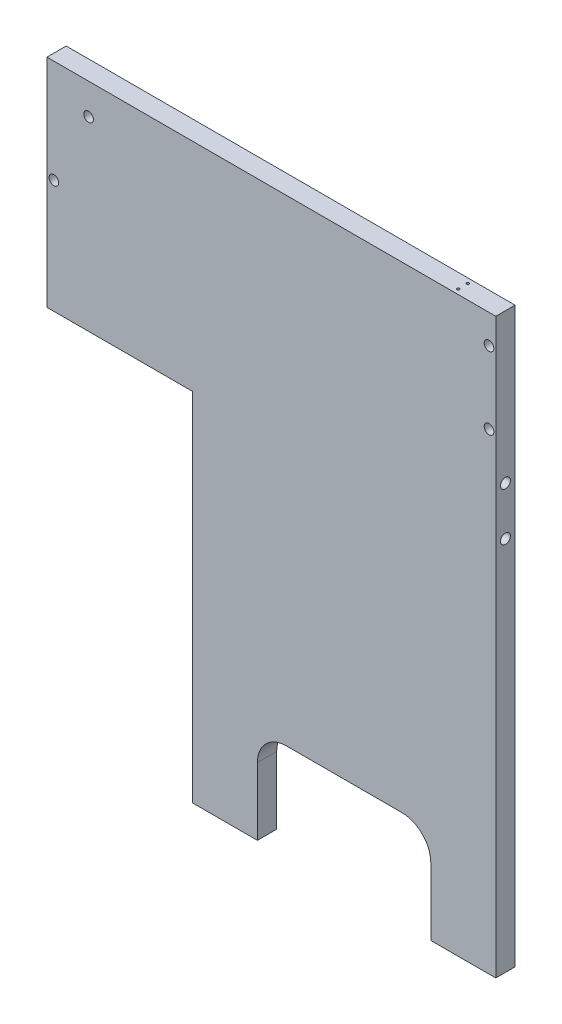
from build123d import *

# Parameters (mm, degrees)
EXTRUDE_1_DEPTH     = 20
SKETCH_2_R          = 5
CUT_EXTRUDE_1_DEPTH = 757.029761319
SKETCH_3_R          = 5.15
CUT_EXTRUDE_2_DEPTH = 20
CUT_EXTRUDE_START   = -20
SKETCH_4_R          = 5.15
CUT_EXTRUDE_3_DEPTH = 20
SKETCH_5_R          = 1.25
CUT_EXTRUDE_4_DEPTH = 10


with BuildPart() as part:
    # 草图1 → 凸台-拉伸1 (new body)
    with BuildSketch(Plane.XY):
        Polygon((0, 0), (466, 0), (466, -595), (151, -595), (151, -225), (0, -225), align=None)
    extrude(amount=-EXTRUDE_1_DEPTH)

    # 草图2 → 切除-拉伸1 (cut, through all)
    with BuildSketch(Plane.XY):
        with Locations((43.2, -32)):
            Circle(SKETCH_2_R)
        with Locations((459, -30)):
            Circle(SKETCH_2_R)
        with Locations((459, -105)):
            Circle(SKETCH_2_R)
        with Locations((7.2, -107)):
            Circle(SKETCH_2_R)
        with BuildLine():
            Line((218.5, -595), (218.5, -525))
            ThreePointArc((218.5, -525), (227.286796564, -503.786796564), (248.5, -495))
            Line((248.5, -495), (368.5, -495))
            ThreePointArc((368.5, -495), (389.713203436, -503.786796564), (398.5, -525))
            Line((398.5, -525), (398.5, -595))
            Line((398.5, -595), (218.5, -595))
        make_face()
    extrude(amount=-CUT_EXTRUDE_1_DEPTH, mode=Mode.SUBTRACT)

    # 草图3 → 切除-拉伸2 (cut)
    with BuildSketch(Plane.ZY):
        with Locations((-10, -155)):
            Circle(SKETCH_3_R)
        with Locations((-10, -205)):
            Circle(SKETCH_3_R)
    extrude(amount=-CUT_EXTRUDE_2_DEPTH, mode=Mode.SUBTRACT)

    # 草图4 → 切除-拉伸3 (cut)
    with BuildSketch(Plane(origin=(466, 0, 0), x_dir=(0, 0, -1), z_dir=(1, 0, 0)).offset(CUT_EXTRUDE_START)):
        with Locations(Location((10, -155, 0), (0, 0, 180))):
            Circle(SKETCH_4_R)
        with Locations(Location((10, -205, 0), (0, 0, 180))):
            Circle(SKETCH_4_R)
    extrude(amount=CUT_EXTRUDE_3_DEPTH, mode=Mode.SUBTRACT)

    # 草图5 → 切除-拉伸4 (cut)
    with BuildSketch(Plane(origin=(0, 0, 0), x_dir=(1, 0, 0), z_dir=(0, 1, 0))):
        with Locations(Location((422, 15, 0), (0, 0, 270))):
            Circle(SKETCH_5_R)
        with Locations(Location((422, 5, 0), (0, 0, 270))):
            Circle(SKETCH_5_R)
    extrude(amount=-CUT_EXTRUDE_4_DEPTH, mode=Mode.SUBTRACT)


solid = part.part
